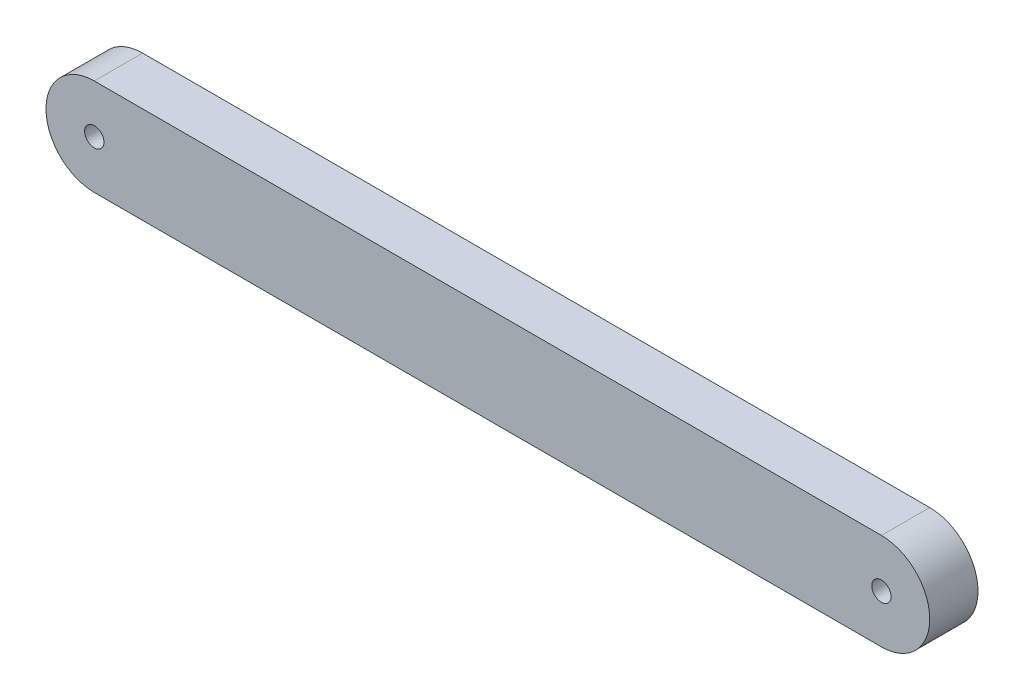
from build123d import *

# Parameters (mm, degrees)
SKETCH1_R           = 2
BOSS_EXTRUDE1_DEPTH = 10


with BuildPart() as part:
    # Sketch1 → Boss-Extrude1 (new body)
    with BuildSketch(Plane.XY):
        with BuildLine():
            Line((-30.232830821, -2.495812395), (-193.232830821, -2.495812395))
            ThreePointArc((-193.232830821, -2.495812395), (-203.232830821, 7.504187605), (-193.232830821, 17.504187605))
            Line((-193.232830821, 17.504187605), (-30.232830821, 17.504187605))
            ThreePointArc((-30.232830821, 17.504187605), (-20.232830821, 7.504187605), (-30.232830821, -2.495812395))
        make_face()
        with Locations((-193.232830821, 7.504187605)):
            Circle(SKETCH1_R, mode=Mode.SUBTRACT)
        with Locations((-30.232830821, 7.504187605)):
            Circle(SKETCH1_R, mode=Mode.SUBTRACT)
    extrude(amount=BOSS_EXTRUDE1_DEPTH)


solid = part.part
